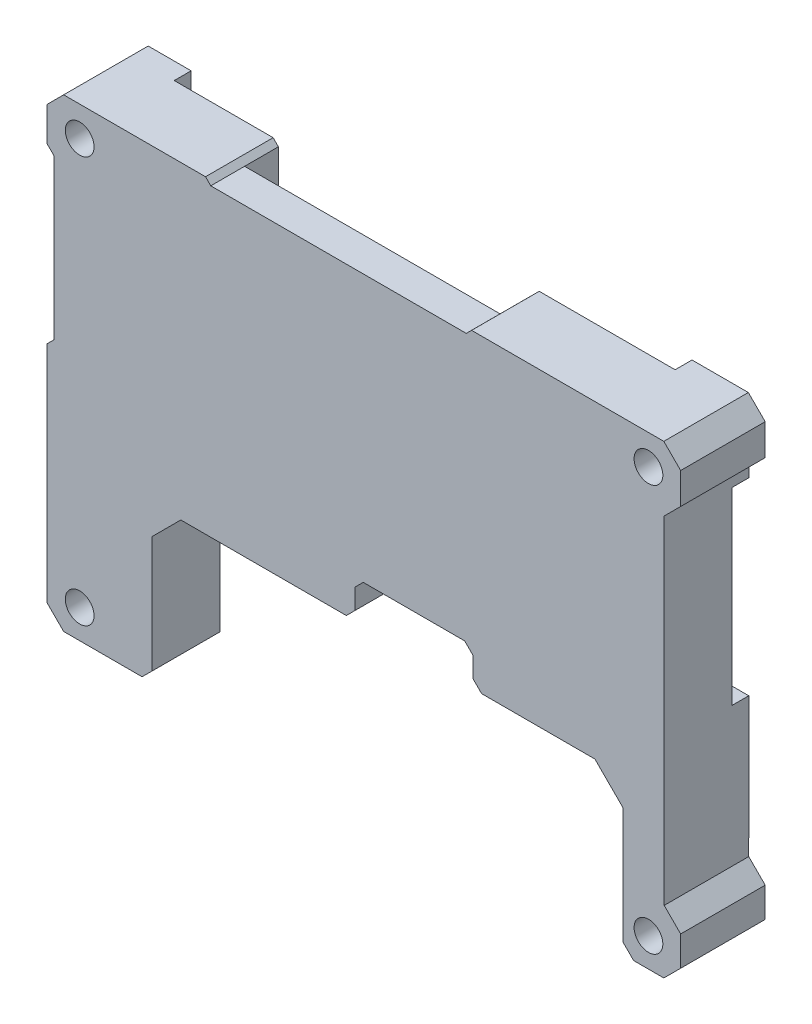
from build123d import *

# Parameters (mm, degrees)
SKETCH_1_W           = 85
SKETCH_1_H           = 65
EXTRUDE_1_DEPTH      = 10
CUT_EXTRUDE_1_REACH  = 109.471
SKETCH_2_R           = 1.7
CUT_EXTRUDE_2_REACH  = 109.471
SKETCH_3_W           = 85
SKETCH_3_H           = 65
CUT_EXTRUDE_4_REACH  = 102.464
CUT_EXTRUDE_7_DEPTH  = 6
SKETCH_6_W           = 4
SKETCH_6_H           = 16
CUT_EXTRUDE_8_DEPTH  = 6
CUT_EXTRUDE_11_DEPTH = 2
SKETCH_15_W          = 14
SKETCH_15_H          = 4.4
CUT_EXTRUDE_13_DEPTH = 8
CHAMFER_1_SIZE       = 1


with BuildPart() as part:
    # 草图1 → 凸台-拉伸1 (new body)
    with BuildSketch(Plane.XY):
        with Locations((42.5, 32.5)):
            Rectangle(SKETCH_1_W, SKETCH_1_H)
    extrude(amount=EXTRUDE_1_DEPTH)

    # 草图2 → 切除-拉伸1 (cut, up to next)
    with BuildSketch(Plane(origin=(0, 0, 0), x_dir=(-1, 0, 0), z_dir=(0, 0, -1)), mode=Mode.PRIVATE) as cut_extrude_1_sk1:
        with Locations((-76.166921514, 56.442524765)):
            Circle(SKETCH_2_R)
    cut_extrude_1_tool1 = extrude(cut_extrude_1_sk1.sketch, amount=-CUT_EXTRUDE_1_REACH, mode=Mode.PRIVATE) & part.part
    # 草图2 → 切除-拉伸1 (cut, up to next)
    with BuildSketch(Plane(origin=(0, 0, 0), x_dir=(-1, 0, 0), z_dir=(0, 0, -1)), mode=Mode.PRIVATE) as cut_extrude_1_sk2:
        with Locations((-8.888803658, 56.442524765)):
            Circle(SKETCH_2_R)
    cut_extrude_1_tool2 = extrude(cut_extrude_1_sk2.sketch, amount=-CUT_EXTRUDE_1_REACH, mode=Mode.PRIVATE) & part.part
    # 草图2 → 切除-拉伸1 (cut, up to next)
    with BuildSketch(Plane(origin=(0, 0, 0), x_dir=(-1, 0, 0), z_dir=(0, 0, -1)), mode=Mode.PRIVATE) as cut_extrude_1_sk3:
        with Locations((-76.166921514, 8.41508509)):
            Circle(SKETCH_2_R)
    cut_extrude_1_tool3 = extrude(cut_extrude_1_sk3.sketch, amount=-CUT_EXTRUDE_1_REACH, mode=Mode.PRIVATE) & part.part
    # 草图2 → 切除-拉伸1 (cut, up to next)
    with BuildSketch(Plane(origin=(0, 0, 0), x_dir=(-1, 0, 0), z_dir=(0, 0, -1)), mode=Mode.PRIVATE) as cut_extrude_1_sk4:
        with Locations((-8.888803658, 8.41508509)):
            Circle(SKETCH_2_R)
    cut_extrude_1_tool4 = extrude(cut_extrude_1_sk4.sketch, amount=-CUT_EXTRUDE_1_REACH, mode=Mode.PRIVATE) & part.part
    add(cut_extrude_1_tool1.solids().sort_by_distance((76.166922, 56.442525, 0))[0], mode=Mode.SUBTRACT)
    add(cut_extrude_1_tool2.solids().sort_by_distance((8.888804, 56.442525, 0))[0], mode=Mode.SUBTRACT)
    add(cut_extrude_1_tool3.solids().sort_by_distance((76.166922, 8.415085, 0))[0], mode=Mode.SUBTRACT)
    add(cut_extrude_1_tool4.solids().sort_by_distance((8.888804, 8.415085, 0))[0], mode=Mode.SUBTRACT)

    # 草图3 → 切除-拉伸2 (cut, up to next)
    with BuildSketch(Plane(origin=(0, 0, 0), x_dir=(-1, 0, 0), z_dir=(0, 0, -1)), mode=Mode.PRIVATE) as cut_extrude_2_sk1:
        with Locations((-42.5, 32.5)):
            Rectangle(SKETCH_3_W, SKETCH_3_H)
        Polygon((-5, 33.462892894), (-5.871324699, 34.334217592), (-5.87504445, 53.137061214), (-5, 54.017366187), (-5, 57.982143592), (-6.992565577, 59.974709169), (-23.773560915, 59.974709169), (-24.394872914, 59.353397171), (-54.61482093, 59.349677419), (-55.245113202, 59.974709169), (-77.982184232, 59.974709169), (-79.974749809, 57.982143592), (-79.97474981, 54.295829484), (-78.032030648, 52.353110322), (-78.028310897, 12.45999492), (-79.97474981, 10.508295484), (-79.97474981, 6.992565577), (-77.982184232, 5), (-74.414239441, 5), (-73.152434681, 6.26180476), (-60.043505207, 6.265524511), (-58.772720173, 5), (-32.926479725, 5), (-31.743585303, 6.182894422), (-17.461559563, 6.186614173), (-16.269684867, 5), (-6.992565577, 5), (-5, 6.992565577), align=None, mode=Mode.SUBTRACT)
    cut_extrude_2_tool1 = extrude(cut_extrude_2_sk1.sketch, amount=-CUT_EXTRUDE_2_REACH, mode=Mode.PRIVATE) & part.part
    add(cut_extrude_2_tool1.solids().sort_by_distance((42.5, 63.929953, 0))[0], mode=Mode.SUBTRACT)

    # 草图4 → 切除-拉伸4 (cut, up to next)
    with BuildSketch(Plane(origin=(0, 0, 0), x_dir=(-1, 0, 0), z_dir=(0, 0, -1)), mode=Mode.PRIVATE) as cut_extrude_4_sk1:
        Polygon((-73.152434681, 6.26180476), (-73.152434681, 20.032317315), (-69.831576581, 23.353175415), (-46.787984184, 23.353175415), (-20.851296271, 23.353175415), (-17.461559563, 19.963438707), (-17.461559563, 6.186614173), (-17.461559563, 0.193960815), (-73.152434681, 0.193960815), align=None)
    cut_extrude_4_tool1 = extrude(cut_extrude_4_sk1.sketch, amount=-CUT_EXTRUDE_4_REACH, mode=Mode.PRIVATE) & part.part
    add(cut_extrude_4_tool1.solids().sort_by_distance((45.311727, 11.681443, 0))[0], mode=Mode.SUBTRACT)

    # 草图5 → 切除-拉伸7 (cut)
    with BuildSketch(Plane(origin=(0, 0, 0), x_dir=(-1, 0, 0), z_dir=(0, 0, -1))):
        Polygon((-24.394872914, 59.353397171), (-24.394872914, 53.906418167), (-25.526104495, 52.774908066), (-53.482640788, 52.774908066), (-54.614150889, 53.906139647), (-54.61482093, 59.349677419), align=None)
    extrude(amount=-CUT_EXTRUDE_7_DEPTH, mode=Mode.SUBTRACT)

    # 草图6 → 切除-拉伸8 (cut)
    with BuildSketch(Plane(origin=(0, 0, 0), x_dir=(-1, 0, 0), z_dir=(0, 0, -1))):
        with Locations((-7.871324699, 42.334217592)):
            Rectangle(SKETCH_6_W, SKETCH_6_H)
    extrude(amount=-CUT_EXTRUDE_8_DEPTH, mode=Mode.SUBTRACT)

    # 草图7 → 切除-拉伸11 (cut)
    with BuildSketch(Plane(origin=(0, 0, 0), x_dir=(-1, 0, 0), z_dir=(0, 0, -1))):
        Polygon((-74.432117646, 51.26230094), (-76.432117646, 51.26230094), (-78.031928938, 51.26230094), (-78.029847328, 28.93771831), (-75.029847328, 28.93771831), (-75.029847328, 13.93771831), (-73.152434681, 12.060305663), (-73.152434681, 20.032317315), (-69.831576581, 23.353175415), (-20.851296271, 23.353175415), (-17.461559563, 19.963438707), (-17.461559563, 6.186614173), (-16.269684867, 5), (-12.014024847, 5), (-12.014024847, 10.599811284), (-10.599811284, 12.014024847), (-6.599811284, 12.014024847), (-5, 12.014024847), (-5, 33.462892894), (-5.871324699, 34.334217592), (-9.871324699, 34.334217592), (-9.871324699, 50.334217592), (-5.874489966, 50.334217592), (-5.87504445, 53.137061214), (-9.87504445, 53.137061214), (-12.071959353, 55.333976117), (-12.071959353, 58.333976117), (-12.071959353, 59.974709169), (-23.773560915, 59.974709169), (-24.394872914, 59.353397171), (-24.394872914, 53.906418167), (-25.526104495, 52.774908066), (-53.482640788, 52.774908066), (-54.614150889, 53.906139647), (-54.61482093, 59.349677419), (-55.245113202, 59.974709169), (-71.319520701, 59.974709169), (-71.319520701, 58.374897885), (-71.319520701, 54.374897885), align=None)
    extrude(amount=-CUT_EXTRUDE_11_DEPTH, mode=Mode.SUBTRACT)

    # 草图15 → 切除-拉伸13 (cut)
    with BuildSketch(Plane.XY.offset(10)):
        with Locations((48.428848604, 25.553175415)):
            Rectangle(SKETCH_15_W, SKETCH_15_H)
    extrude(amount=-CUT_EXTRUDE_13_DEPTH, mode=Mode.SUBTRACT)

    # 倒角1
    chamfer_1_edges = [part.edges().sort_by_distance(p)[0] for p in [
        (55.428848604, 23.353175415, 6),
        (55.428848604, 27.753175415, 6),
        (41.428848604, 27.753175415, 6),
        (41.428848604, 23.353175415, 6),
    ]]
    chamfer(chamfer_1_edges, length=CHAMFER_1_SIZE)


solid = part.part
